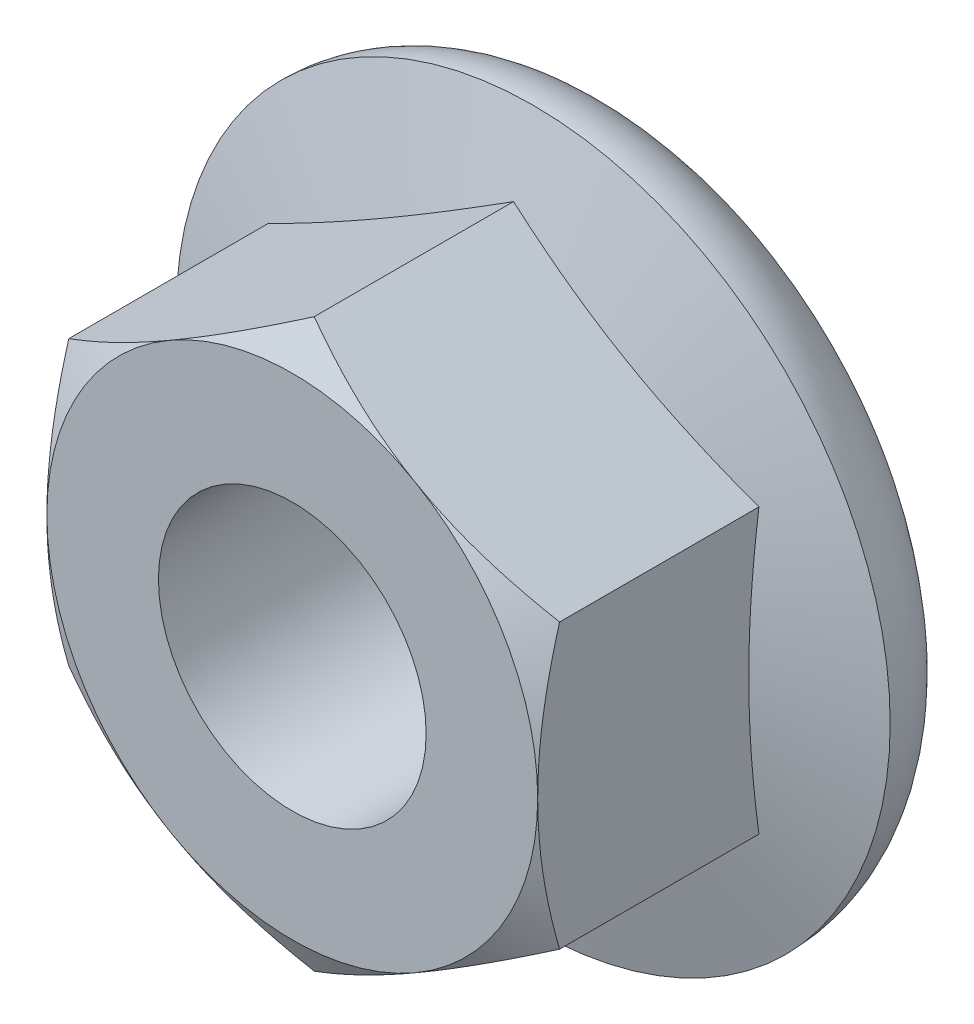
from build123d import *

# Parameters (mm, degrees)
EXTRUDE1_DEPTH     = 2.7
SKETCH4_R          = 1.5
CUT_EXTRUDE1_DEPTH = 7.759437846


with BuildPart() as part:
    # Sketch1 → Extrude1 (new body)
    with BuildSketch(Plane.XY.offset(1)):
        Polygon((0, 3.175426481), (-2.75, 1.58771324), (-2.75, -1.58771324), (0, -3.175426481), (2.75, -1.58771324), (2.75, 1.58771324), align=None)
    extrude(amount=EXTRUDE1_DEPTH)

    # Sketch2 → Revolve1 (revolve)
    with BuildSketch(Plane(origin=(0, 0, 0), x_dir=(0, 0, -1), z_dir=(1, 0, 0)), mode=Mode.PRIVATE) as revolve1_sk:
        with BuildLine():
            Line((0, 0), (0, 3))
            ThreePointArc((0, 3), (-0.292893219, 3.707106781), (-1, 4))
            Line((-1, 4), (-2.07179677, 0))
            Line((-2.07179677, 0), (0, 0))
        make_face()
    revolve(revolve1_sk.sketch.rotate(Axis((0, 0, 0), (0, 0, 1)), 90), axis=Axis((0, 0, 0), (0, 0, 1)))

    # Sketch3 → Cut-Revolve1 (revolve, cut)
    with BuildSketch(Plane(origin=(0, 0, 0), x_dir=(1, 0, 0), z_dir=(0, 1, 0))):
        Polygon((-2.75, -3.7), (-3.85, -3.7), (-3.85, -3.064914704), align=None)
    revolve(axis=Axis((0, 0, 0), (0, 0, 1)), mode=Mode.SUBTRACT)

    # Sketch4 → Cut-Extrude1 (cut, through all)
    with BuildSketch(Plane(origin=(0, 0, 0), x_dir=(-1, 0, 0), z_dir=(0, 0, -1))):
        Circle(SKETCH4_R)
    extrude(amount=-CUT_EXTRUDE1_DEPTH, mode=Mode.SUBTRACT)


solid = part.part
